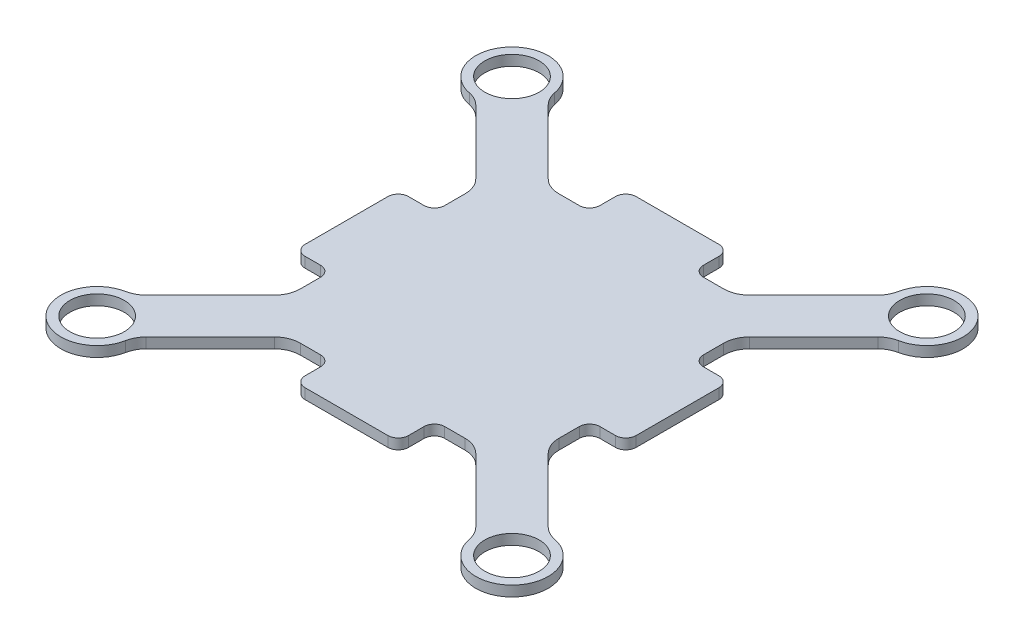
from build123d import *

# Parameters (mm, degrees)
SKETCH_1_R      = 5.25
EXTRUDE_1_DEPTH = 2


with BuildPart() as part:
    # 草图1 → 凸台-拉伸1 (new body)
    with BuildSketch(Plane(origin=(0, 0, 0), x_dir=(1, 0, 0), z_dir=(0, 1, 0))):
        with BuildLine():
            Line((-15.928932188, -25), (-12, -25))
            ThreePointArc((-12, -25), (-10.585786438, -25.585786438), (-10, -27))
            Line((-10, -27), (-10, -30))
            ThreePointArc((-10, -30), (-9.414213562, -31.414213562), (-8, -32))
            Line((-8, -32), (8, -32))
            ThreePointArc((8, -32), (9.414213562, -31.414213562), (10, -30))
            Line((10, -30), (10, -27))
            ThreePointArc((10, -27), (10.585786438, -25.585786438), (12, -25))
            Line((12, -25), (15.928932188, -25))
            ThreePointArc((15.928932188, -25), (17.84234935, -25.380602337), (19.464466094, -26.464466094))
            Line((19.464466094, -26.464466094), (31.856955479, -38.856955479))
            ThreePointArc((31.856955479, -38.856955479), (32.735932701, -40.044705003), (33.229373027, -41.437495918))
            ThreePointArc((33.229373027, -41.437495918), (45.050252532, -45.050252532), (41.437495918, -33.229373027))
            ThreePointArc((41.437495918, -33.229373027), (40.044705003, -32.735932701), (38.856955479, -31.856955479))
            Line((38.856955479, -31.856955479), (26.464466094, -19.464466094))
            ThreePointArc((26.464466094, -19.464466094), (25.380602337, -17.84234935), (25, -15.928932188))
            Line((25, -15.928932188), (25, -12))
            ThreePointArc((25, -12), (25.585786438, -10.585786438), (27, -10))
            Line((27, -10), (30, -10))
            ThreePointArc((30, -10), (31.414213562, -9.414213562), (32, -8))
            Line((32, -8), (32, 8))
            ThreePointArc((32, 8), (31.414213562, 9.414213562), (30, 10))
            Line((30, 10), (27, 10))
            ThreePointArc((27, 10), (25.585786438, 10.585786438), (25, 12))
            Line((25, 12), (25, 15.928932188))
            ThreePointArc((25, 15.928932188), (25.380602337, 17.84234935), (26.464466094, 19.464466094))
            Line((26.464466094, 19.464466094), (38.856955479, 31.856955479))
            ThreePointArc((38.856955479, 31.856955479), (40.044705003, 32.735932701), (41.437495918, 33.229373027))
            ThreePointArc((41.437495918, 33.229373027), (45.050252532, 45.050252532), (33.229373027, 41.437495918))
            ThreePointArc((33.229373027, 41.437495918), (32.735932701, 40.044705003), (31.856955479, 38.856955479))
            Line((31.856955479, 38.856955479), (19.464466094, 26.464466094))
            ThreePointArc((19.464466094, 26.464466094), (17.84234935, 25.380602337), (15.928932188, 25))
            Line((15.928932188, 25), (12, 25))
            ThreePointArc((12, 25), (10.585786438, 25.585786438), (10, 27))
            Line((10, 27), (10, 30))
            ThreePointArc((10, 30), (9.414213562, 31.414213562), (8, 32))
            Line((8, 32), (-8, 32))
            ThreePointArc((-8, 32), (-9.414213562, 31.414213562), (-10, 30))
            Line((-10, 30), (-10, 27))
            ThreePointArc((-10, 27), (-10.585786438, 25.585786438), (-12, 25))
            Line((-12, 25), (-15.928932188, 25))
            ThreePointArc((-15.928932188, 25), (-17.84234935, 25.380602337), (-19.464466094, 26.464466094))
            Line((-19.464466094, 26.464466094), (-31.856955479, 38.856955479))
            ThreePointArc((-31.856955479, 38.856955479), (-32.735932701, 40.044705003), (-33.229373027, 41.437495918))
            ThreePointArc((-33.229373027, 41.437495918), (-45.050252532, 45.050252532), (-41.437495918, 33.229373027))
            ThreePointArc((-41.437495918, 33.229373027), (-40.044705003, 32.735932701), (-38.856955479, 31.856955479))
            Line((-38.856955479, 31.856955479), (-26.464466094, 19.464466094))
            ThreePointArc((-26.464466094, 19.464466094), (-25.380602337, 17.84234935), (-25, 15.928932188))
            Line((-25, 15.928932188), (-25, 12))
            ThreePointArc((-25, 12), (-25.585786438, 10.585786438), (-27, 10))
            Line((-27, 10), (-30, 10))
            ThreePointArc((-30, 10), (-31.414213562, 9.414213562), (-32, 8))
            Line((-32, 8), (-32, -8))
            ThreePointArc((-32, -8), (-31.414213562, -9.414213562), (-30, -10))
            Line((-30, -10), (-27, -10))
            ThreePointArc((-27, -10), (-25.585786438, -10.585786438), (-25, -12))
            Line((-25, -12), (-25, -15.928932188))
            ThreePointArc((-25, -15.928932188), (-25.380602337, -17.84234935), (-26.464466094, -19.464466094))
            Line((-26.464466094, -19.464466094), (-38.856955479, -31.856955479))
            ThreePointArc((-38.856955479, -31.856955479), (-40.044705003, -32.735932701), (-41.437495918, -33.229373027))
            ThreePointArc((-41.437495918, -33.229373027), (-45.050252532, -45.050252532), (-33.229373027, -41.437495918))
            ThreePointArc((-33.229373027, -41.437495918), (-32.735932701, -40.044705003), (-31.856955479, -38.856955479))
            Line((-31.856955479, -38.856955479), (-19.464466094, -26.464466094))
            ThreePointArc((-19.464466094, -26.464466094), (-17.84234935, -25.380602337), (-15.928932188, -25))
        make_face()
        with Locations(Location((-40.100505063, 40.100505063, 0), (0, 0, 270))):
            Circle(SKETCH_1_R, mode=Mode.SUBTRACT)
        with Locations(Location((40.100505063, 40.100505063, 0), (0, 0, 270))):
            Circle(SKETCH_1_R, mode=Mode.SUBTRACT)
        with Locations(Location((40.100505063, -40.100505063, 0), (0, 0, 270))):
            Circle(SKETCH_1_R, mode=Mode.SUBTRACT)
        with Locations(Location((-40.100505063, -40.100505063, 0), (0, 0, 270))):
            Circle(SKETCH_1_R, mode=Mode.SUBTRACT)
    extrude(amount=EXTRUDE_1_DEPTH)


solid = part.part
